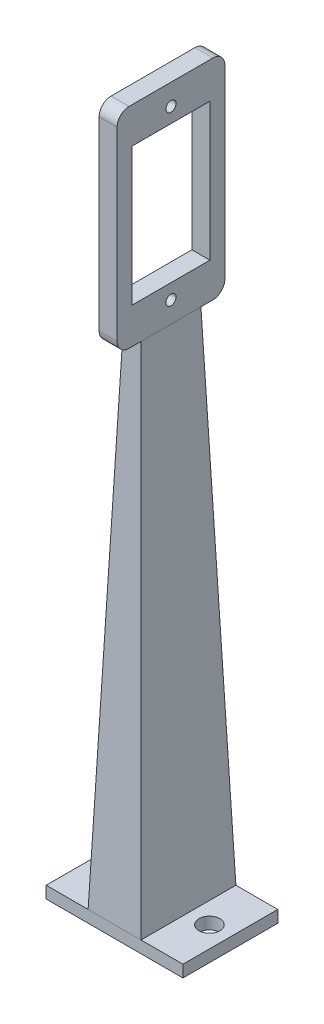
from build123d import *

# Parameters (mm, degrees)
ESBO_O1_W                = 18
ESBO_O1_H                = 35
RESSALTO_EXTRUS_O1_DEPTH = 1.5
CORTE_EXTRUS_O1_REACH    = 21.906
ESBO_O2_W                = 13
ESBO_O2_H                = 23
CORTE_EXTRUS_O2_REACH    = 21.906
ESBO_O3_R                = 0.85
FILETE1_R                = 2
ESBO_O4_W                = 3
ESBO_O4_H                = 10
RESSALTO_EXTRUS_O2_DEPTH = 83.68
RESSALTO_EXTRUS_O2_TAPER = -2
ESBO_O5_W                = 22.844339982
ESBO_O5_H                = 15.844339982
RESSALTO_EXTRUS_O3_DEPTH = 2
CORTE_EXTRUS_O3_REACH    = 121.568
ESBO_O6_R                = 1.75


with BuildPart() as part:
    # Esboço1 → Ressalto-extrusão1 (new, symmetric)
    with BuildSketch(Plane(origin=(0, 0, 0), x_dir=(0, 0, -1), z_dir=(1, 0, 0))):
        Rectangle(ESBO_O1_W, ESBO_O1_H)
    extrude(amount=RESSALTO_EXTRUS_O1_DEPTH, both=True)

    # Esboço2 → Corte-extrusão1 (cut, up to next)
    with BuildSketch(Plane(origin=(1.5, 0, 0), x_dir=(0, 0, -1), z_dir=(1, 0, 0)), mode=Mode.PRIVATE) as corte_extrus_o1_sk1:
        Rectangle(ESBO_O2_W, ESBO_O2_H)
    corte_extrus_o1_tool1 = extrude(corte_extrus_o1_sk1.sketch, amount=-CORTE_EXTRUS_O1_REACH, mode=Mode.PRIVATE) & part.part
    add(corte_extrus_o1_tool1.solids().sort_by_distance((1.5, 0, 0))[0], mode=Mode.SUBTRACT)

    # Esboço3 → Corte-extrusão2 (cut, up to next)
    with BuildSketch(Plane.ZY.offset(1.5), mode=Mode.PRIVATE) as corte_extrus_o2_sk1:
        with Locations((0, 14)):
            Circle(ESBO_O3_R)
    corte_extrus_o2_tool1 = extrude(corte_extrus_o2_sk1.sketch, amount=-CORTE_EXTRUS_O2_REACH, mode=Mode.PRIVATE) & part.part
    # Esboço3 → Corte-extrusão2 (cut, up to next)
    with BuildSketch(Plane.ZY.offset(1.5), mode=Mode.PRIVATE) as corte_extrus_o2_sk2:
        with Locations((0, -14)):
            Circle(ESBO_O3_R)
    corte_extrus_o2_tool2 = extrude(corte_extrus_o2_sk2.sketch, amount=-CORTE_EXTRUS_O2_REACH, mode=Mode.PRIVATE) & part.part
    add(corte_extrus_o2_tool1.solids().sort_by_distance((-1.5, 14, 0))[0], mode=Mode.SUBTRACT)
    add(corte_extrus_o2_tool2.solids().sort_by_distance((-1.5, -14, 0))[0], mode=Mode.SUBTRACT)

    # Filete1
    filete1_edges = [part.edges().sort_by_distance(p)[0] for p in [
        (0, -17.5, -9),
        (0, -17.5, 9),
        (0, 17.5, 9),
        (0, 17.5, -9),
    ]]
    fillet(filete1_edges, radius=FILETE1_R)

    # Esboço4 → Ressalto-extrusão2 (add)
    with BuildSketch(Plane.XZ.offset(17.5)):
        Rectangle(ESBO_O4_W, ESBO_O4_H)
    extrude(amount=RESSALTO_EXTRUS_O2_DEPTH, taper=RESSALTO_EXTRUS_O2_TAPER)

    # Esboço5 → Ressalto-extrusão3 (add)
    with BuildSketch(Plane.XZ.offset(101.18)):
        Rectangle(ESBO_O5_W, ESBO_O5_H)
    extrude(amount=RESSALTO_EXTRUS_O3_DEPTH)

    # Esboço6 → Corte-extrusão3 (cut, up to next)
    with BuildSketch(Plane(origin=(0, -101.18, 0), x_dir=(1, 0, 0), z_dir=(0, 1, 0)), mode=Mode.PRIVATE) as corte_extrus_o3_sk1:
        with Locations(Location((7.922169991, 0, 0), (0, 0, 270))):
            Circle(ESBO_O6_R)
    corte_extrus_o3_tool1 = extrude(corte_extrus_o3_sk1.sketch, amount=-CORTE_EXTRUS_O3_REACH, mode=Mode.PRIVATE) & part.part
    # Esboço6 → Corte-extrusão3 (cut, up to next)
    with BuildSketch(Plane(origin=(0, -101.18, 0), x_dir=(1, 0, 0), z_dir=(0, 1, 0)), mode=Mode.PRIVATE) as corte_extrus_o3_sk2:
        with Locations(Location((-7.922169991, 0, 0), (0, 0, 270))):
            Circle(ESBO_O6_R)
    corte_extrus_o3_tool2 = extrude(corte_extrus_o3_sk2.sketch, amount=-CORTE_EXTRUS_O3_REACH, mode=Mode.PRIVATE) & part.part
    add(corte_extrus_o3_tool1.solids().sort_by_distance((7.92217, -101.18, 0))[0], mode=Mode.SUBTRACT)
    add(corte_extrus_o3_tool2.solids().sort_by_distance((-7.92217, -101.18, 0))[0], mode=Mode.SUBTRACT)


solid = part.part
